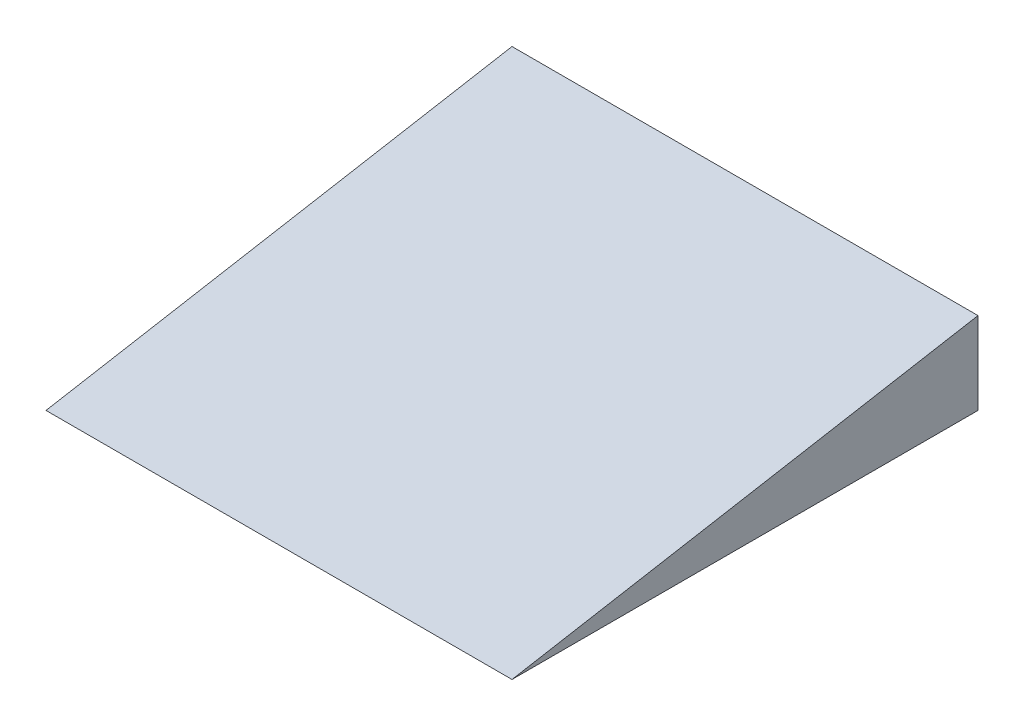
from build123d import *

# Parameters (mm, degrees)
BOSS_EXTRUDE2_DEPTH = 40


with BuildPart() as part:
    # Sketch4 → Boss-Extrude2 (new body)
    with BuildSketch(Plane(origin=(0, 0, 0), x_dir=(0, 0, -1), z_dir=(1, 0, 0))):
        Polygon((0, 0), (40, 0), (40, 7.053079228), align=None)
    extrude(amount=BOSS_EXTRUDE2_DEPTH)


solid = part.part
